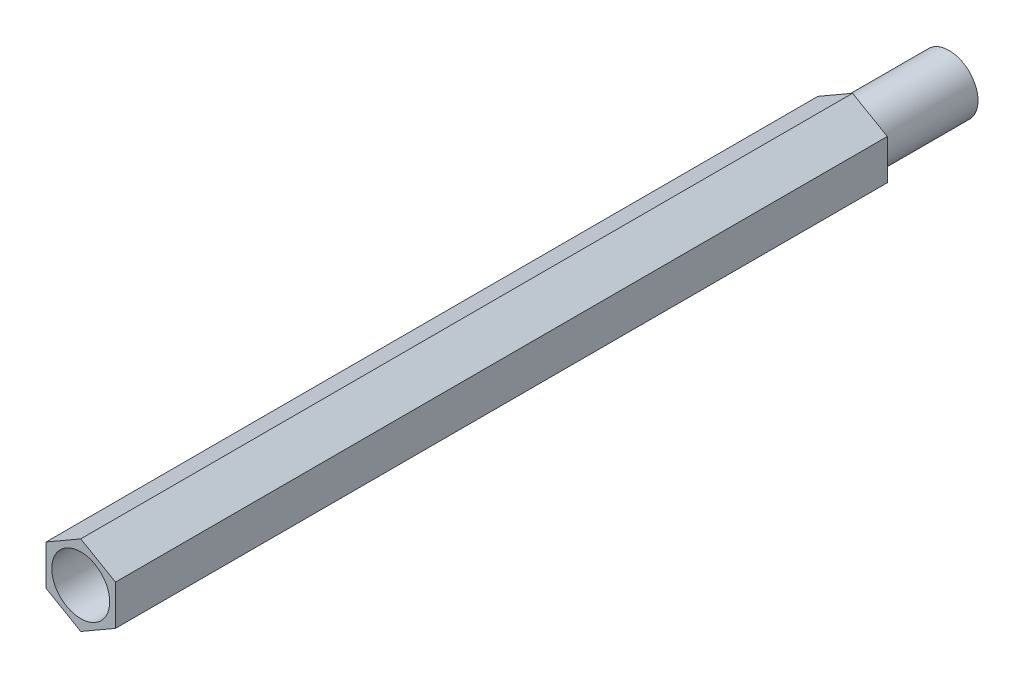
from build123d import *

# Parameters (mm, degrees)
SKETCH_1_R      = 1.5
EXTRUDE_1_DEPTH = 40
SKETCH_2_R      = 1.5
EXTRUDE_2_DEPTH = 5


with BuildPart() as part:
    # 草图1 → 凸台-拉伸1 (new body)
    with BuildSketch(Plane.XY):
        Polygon((0, 2.078460969), (-1.8, 1.039230485), (-1.8, -1.039230485), (0, -2.078460969), (1.8, -1.039230485), (1.8, 1.039230485), align=None)
        Circle(SKETCH_1_R, mode=Mode.SUBTRACT)
    extrude(amount=EXTRUDE_1_DEPTH)

    # 草图2 → 凸台-拉伸2 (add, symmetric)
    with BuildSketch(Plane(origin=(0, 0, 0), x_dir=(-1, 0, 0), z_dir=(0, 0, -1))):
        Circle(SKETCH_2_R)
    extrude(amount=EXTRUDE_2_DEPTH, both=True)


solid = part.part
